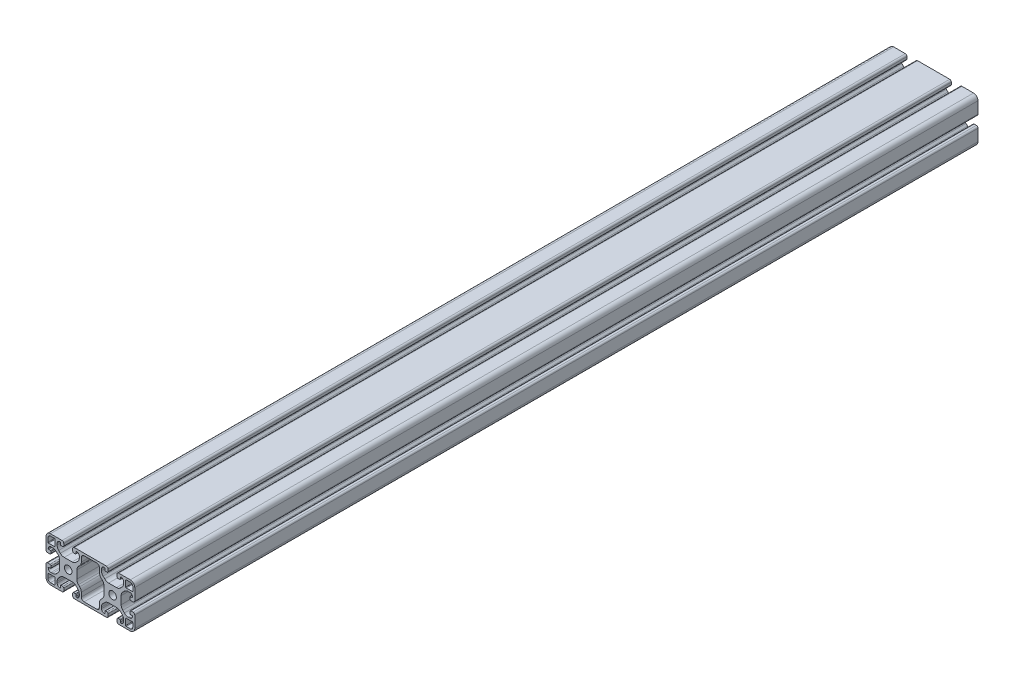
from build123d import *

# Parameters (mm, degrees)
ESQUISSE1_R        = 3.4
BOSS_EXTRU_1_DEPTH = 760


with BuildPart() as part:
    # Esquisse1 → Boss.-Extru.1 (new body)
    with BuildSketch(Plane.XY.offset(20)):
        with BuildLine():
            Line((66.5, 4.5), (65, 4.5))
            ThreePointArc((65, 4.5), (64.292893219, 4.207106781), (64, 3.5))
            Line((64, 3.5), (64, 1.5))
            ThreePointArc((64, 1.5), (64.439339828, 0.439339828), (65.5, 0))
            Line((65.5, 0), (76, 0))
            ThreePointArc((76, 0), (78.828427125, 1.171572875), (80, 4))
            Line((80, 4), (80, 14.5))
            ThreePointArc((80, 14.5), (79.560660172, 15.560660172), (78.5, 16))
            Line((78.5, 16), (76.5, 16))
            ThreePointArc((76.5, 16), (75.792893219, 15.707106781), (75.5, 15))
            Line((75.5, 15), (75.5, 13.5))
            ThreePointArc((75.5, 13.5), (75.646446609, 13.146446609), (76, 13))
            Line((76, 13), (77.5, 13))
            ThreePointArc((77.5, 13), (77.853553391, 12.853553391), (78, 12.5))
            ThreePointArc((78, 12.5), (77.267766953, 10.732233047), (75.5, 10))
            Line((75.5, 10), (74.192388155, 10))
            ThreePointArc((74.192388155, 10), (72.278970994, 10.380602337), (70.656854249, 11.464466094))
            Line((70.656854249, 11.464466094), (69.214466094, 12.906854249))
            ThreePointArc((69.214466094, 12.906854249), (68.130602337, 14.528970994), (67.75, 16.442388155))
            Line((67.75, 16.442388155), (67.75, 23.557611845))
            ThreePointArc((67.75, 23.557611845), (68.130602337, 25.471029006), (69.214466094, 27.093145751))
            Line((69.214466094, 27.093145751), (70.656854249, 28.535533906))
            ThreePointArc((70.656854249, 28.535533906), (72.278970994, 29.619397663), (74.192388155, 30))
            Line((74.192388155, 30), (75.5, 30))
            ThreePointArc((75.5, 30), (77.267766953, 29.267766953), (78, 27.5))
            ThreePointArc((78, 27.5), (77.853553391, 27.146446609), (77.5, 27))
            Line((77.5, 27), (76, 27))
            ThreePointArc((76, 27), (75.646446609, 26.853553391), (75.5, 26.5))
            Line((75.5, 26.5), (75.5, 25))
            ThreePointArc((75.5, 25), (75.792893219, 24.292893219), (76.5, 24))
            Line((76.5, 24), (78.5, 24))
            ThreePointArc((78.5, 24), (79.560660172, 24.439339828), (80, 25.5))
            Line((80, 25.5), (80, 36))
            ThreePointArc((80, 36), (78.828427125, 38.828427125), (76, 40))
            Line((76, 40), (65.5, 40))
            ThreePointArc((65.5, 40), (64.439339828, 39.560660172), (64, 38.5))
            Line((64, 38.5), (64, 36.5))
            ThreePointArc((64, 36.5), (64.292893219, 35.792893219), (65, 35.5))
            Line((65, 35.5), (66.5, 35.5))
            ThreePointArc((66.5, 35.5), (66.853553391, 35.646446609), (67, 36))
            Line((67, 36), (67, 37.5))
            ThreePointArc((67, 37.5), (67.146446609, 37.853553391), (67.5, 38))
            ThreePointArc((67.5, 38), (69.267766953, 37.267766953), (70, 35.5))
            Line((70, 35.5), (70, 34.192388155))
            ThreePointArc((70, 34.192388155), (69.619397663, 32.278970994), (68.535533906, 30.656854249))
            Line((68.535533906, 30.656854249), (67.093145751, 29.214466094))
            ThreePointArc((67.093145751, 29.214466094), (65.471029006, 28.130602337), (63.557611845, 27.75))
            Line((63.557611845, 27.75), (56.442388155, 27.75))
            ThreePointArc((56.442388155, 27.75), (54.528970994, 28.130602337), (52.906854249, 29.214466094))
            Line((52.906854249, 29.214466094), (51.464466094, 30.656854249))
            ThreePointArc((51.464466094, 30.656854249), (50.380602337, 32.278970994), (50, 34.192388155))
            Line((50, 34.192388155), (50, 35.5))
            ThreePointArc((50, 35.5), (50.732233047, 37.267766953), (52.5, 38))
            ThreePointArc((52.5, 38), (52.853553391, 37.853553391), (53, 37.5))
            Line((53, 37.5), (53, 36))
            ThreePointArc((53, 36), (53.146446609, 35.646446609), (53.5, 35.5))
            Line((53.5, 35.5), (55, 35.5))
            ThreePointArc((55, 35.5), (55.707106781, 35.792893219), (56, 36.5))
            Line((56, 36.5), (56, 38.5))
            ThreePointArc((56, 38.5), (55.560660172, 39.560660172), (54.5, 40))
            Line((54.5, 40), (25.5, 40))
            ThreePointArc((25.5, 40), (24.439339828, 39.560660172), (24, 38.5))
            Line((24, 38.5), (24, 36.5))
            ThreePointArc((24, 36.5), (24.292893219, 35.792893219), (25, 35.5))
            Line((25, 35.5), (26.5, 35.5))
            ThreePointArc((26.5, 35.5), (26.853553391, 35.646446609), (27, 36))
            Line((27, 36), (27, 37.5))
            ThreePointArc((27, 37.5), (27.146446609, 37.853553391), (27.5, 38))
            ThreePointArc((27.5, 38), (29.267766953, 37.267766953), (30, 35.5))
            Line((30, 35.5), (30, 34.192388155))
            ThreePointArc((30, 34.192388155), (29.619397663, 32.278970994), (28.535533906, 30.656854249))
            Line((28.535533906, 30.656854249), (27.093145751, 29.214466094))
            ThreePointArc((27.093145751, 29.214466094), (25.471029006, 28.130602337), (23.557611845, 27.75))
            Line((23.557611845, 27.75), (16.442388155, 27.75))
            ThreePointArc((16.442388155, 27.75), (14.528970994, 28.130602337), (12.906854249, 29.214466094))
            Line((12.906854249, 29.214466094), (11.464466094, 30.656854249))
            ThreePointArc((11.464466094, 30.656854249), (10.380602337, 32.278970994), (10, 34.192388155))
            Line((10, 34.192388155), (10, 35.5))
            ThreePointArc((10, 35.5), (10.732233047, 37.267766953), (12.5, 38))
            ThreePointArc((12.5, 38), (12.853553391, 37.853553391), (13, 37.5))
            Line((13, 37.5), (13, 36))
            ThreePointArc((13, 36), (13.146446609, 35.646446609), (13.5, 35.5))
            Line((13.5, 35.5), (15, 35.5))
            ThreePointArc((15, 35.5), (15.707106781, 35.792893219), (16, 36.5))
            Line((16, 36.5), (16, 38.5))
            ThreePointArc((16, 38.5), (15.560660172, 39.560660172), (14.5, 40))
            Line((14.5, 40), (4, 40))
            ThreePointArc((4, 40), (1.171572875, 38.828427125), (0, 36))
            Line((0, 36), (0, 25.5))
            ThreePointArc((0, 25.5), (0.439339828, 24.439339828), (1.5, 24))
            Line((1.5, 24), (3.5, 24))
            ThreePointArc((3.5, 24), (4.207106781, 24.292893219), (4.5, 25))
            Line((4.5, 25), (4.5, 26.5))
            ThreePointArc((4.5, 26.5), (4.353553391, 26.853553391), (4, 27))
            Line((4, 27), (2.5, 27))
            ThreePointArc((2.5, 27), (2.146446609, 27.146446609), (2, 27.5))
            ThreePointArc((2, 27.5), (2.732233047, 29.267766953), (4.5, 30))
            Line((4.5, 30), (5.807611845, 30))
            ThreePointArc((5.807611845, 30), (7.721029006, 29.619397663), (9.343145751, 28.535533906))
            Line((9.343145751, 28.535533906), (10.785533906, 27.093145751))
            ThreePointArc((10.785533906, 27.093145751), (11.869397663, 25.471029006), (12.25, 23.557611845))
            Line((12.25, 23.557611845), (12.25, 16.442388155))
            ThreePointArc((12.25, 16.442388155), (11.869397663, 14.528970994), (10.785533906, 12.906854249))
            Line((10.785533906, 12.906854249), (9.343145751, 11.464466094))
            ThreePointArc((9.343145751, 11.464466094), (7.721029006, 10.380602337), (5.807611845, 10))
            Line((5.807611845, 10), (4.5, 10))
            ThreePointArc((4.5, 10), (2.732233047, 10.732233047), (2, 12.5))
            ThreePointArc((2, 12.5), (2.146446609, 12.853553391), (2.5, 13))
            Line((2.5, 13), (4, 13))
            ThreePointArc((4, 13), (4.353553391, 13.146446609), (4.5, 13.5))
            Line((4.5, 13.5), (4.5, 15))
            ThreePointArc((4.5, 15), (4.207106781, 15.707106781), (3.5, 16))
            Line((3.5, 16), (1.5, 16))
            ThreePointArc((1.5, 16), (0.439339828, 15.560660172), (0, 14.5))
            Line((0, 14.5), (0, 4))
            ThreePointArc((0, 4), (1.171572875, 1.171572875), (4, 0))
            Line((4, 0), (14.5, 0))
            ThreePointArc((14.5, 0), (15.560660172, 0.439339828), (16, 1.5))
            Line((16, 1.5), (16, 3.5))
            ThreePointArc((16, 3.5), (15.707106781, 4.207106781), (15, 4.5))
            Line((15, 4.5), (13.5, 4.5))
            ThreePointArc((13.5, 4.5), (13.146446609, 4.353553391), (13, 4))
            Line((13, 4), (13, 2.5))
            ThreePointArc((13, 2.5), (12.853553391, 2.146446609), (12.5, 2))
            ThreePointArc((12.5, 2), (10.732233047, 2.732233047), (10, 4.5))
            Line((10, 4.5), (10, 5.807611845))
            ThreePointArc((10, 5.807611845), (10.380602337, 7.721029006), (11.464466094, 9.343145751))
            Line((11.464466094, 9.343145751), (12.906854249, 10.785533906))
            ThreePointArc((12.906854249, 10.785533906), (14.528970994, 11.869397663), (16.442388155, 12.25))
            Line((16.442388155, 12.25), (23.557611845, 12.25))
            ThreePointArc((23.557611845, 12.25), (25.471029006, 11.869397663), (27.093145751, 10.785533906))
            Line((27.093145751, 10.785533906), (28.535533906, 9.343145751))
            ThreePointArc((28.535533906, 9.343145751), (29.619397663, 7.721029006), (30, 5.807611845))
            Line((30, 5.807611845), (30, 4.5))
            ThreePointArc((30, 4.5), (29.267766953, 2.732233047), (27.5, 2))
            ThreePointArc((27.5, 2), (27.146446609, 2.146446609), (27, 2.5))
            Line((27, 2.5), (27, 4))
            ThreePointArc((27, 4), (26.853553391, 4.353553391), (26.5, 4.5))
            Line((26.5, 4.5), (25, 4.5))
            ThreePointArc((25, 4.5), (24.292893219, 4.207106781), (24, 3.5))
            Line((24, 3.5), (24, 1.5))
            ThreePointArc((24, 1.5), (24.439339828, 0.439339828), (25.5, 0))
            Line((25.5, 0), (54.5, 0))
            ThreePointArc((54.5, 0), (55.560660172, 0.439339828), (56, 1.5))
            Line((56, 1.5), (56, 3.5))
            ThreePointArc((56, 3.5), (55.707106781, 4.207106781), (55, 4.5))
            Line((55, 4.5), (53.5, 4.5))
            ThreePointArc((53.5, 4.5), (53.146446609, 4.353553391), (53, 4))
            Line((53, 4), (53, 2.5))
            ThreePointArc((53, 2.5), (52.853553391, 2.146446609), (52.5, 2))
            ThreePointArc((52.5, 2), (50.732233047, 2.732233047), (50, 4.5))
            Line((50, 4.5), (50, 5.807611845))
            ThreePointArc((50, 5.807611845), (50.380602337, 7.721029006), (51.464466094, 9.343145751))
            Line((51.464466094, 9.343145751), (52.906854249, 10.785533906))
            ThreePointArc((52.906854249, 10.785533906), (54.528970994, 11.869397663), (56.442388155, 12.25))
            Line((56.442388155, 12.25), (63.557611845, 12.25))
            ThreePointArc((63.557611845, 12.25), (65.471029006, 11.869397663), (67.093145751, 10.785533906))
            Line((67.093145751, 10.785533906), (68.535533906, 9.343145751))
            ThreePointArc((68.535533906, 9.343145751), (69.619397663, 7.721029006), (70, 5.807611845))
            Line((70, 5.807611845), (70, 4.5))
            ThreePointArc((70, 4.5), (69.267766953, 2.732233047), (67.5, 2))
            ThreePointArc((67.5, 2), (67.146446609, 2.146446609), (67, 2.5))
            Line((67, 2.5), (67, 4))
            ThreePointArc((67, 4), (66.853553391, 4.353553391), (66.5, 4.5))
        make_face()
        with Locations(Location((20, 20, 0), (0, 0, 180))):
            Circle(ESQUISSE1_R, mode=Mode.SUBTRACT)
        with Locations(Location((60, 20, 0), (0, 0, 180))):
            Circle(ESQUISSE1_R, mode=Mode.SUBTRACT)
        with BuildLine():
            Line((31.8, 4.5), (31.8, 8.250252532))
            ThreePointArc((31.8, 8.250252532), (31.419397663, 10.163669694), (30.335533906, 11.785786438))
            Line((30.335533906, 11.785786438), (29.214466094, 12.906854249))
            ThreePointArc((29.214466094, 12.906854249), (28.130602337, 14.528970994), (27.75, 16.442388155))
            Line((27.75, 16.442388155), (27.75, 23.557611845))
            ThreePointArc((27.75, 23.557611845), (28.130602337, 25.471029006), (29.214466094, 27.093145751))
            Line((29.214466094, 27.093145751), (30.335533906, 28.214213562))
            ThreePointArc((30.335533906, 28.214213562), (31.419397663, 29.836330306), (31.8, 31.749747468))
            Line((31.8, 31.749747468), (31.8, 35.5))
            ThreePointArc((31.8, 35.5), (32.532233047, 37.267766953), (34.3, 38))
            Line((34.3, 38), (45.7, 38))
            ThreePointArc((45.7, 38), (47.467766953, 37.267766953), (48.2, 35.5))
            Line((48.2, 35.5), (48.2, 31.749747468))
            ThreePointArc((48.2, 31.749747468), (48.580602337, 29.836330306), (49.664466094, 28.214213562))
            Line((49.664466094, 28.214213562), (50.785533906, 27.093145751))
            ThreePointArc((50.785533906, 27.093145751), (51.869397663, 25.471029006), (52.25, 23.557611845))
            Line((52.25, 23.557611845), (52.25, 16.442388155))
            ThreePointArc((52.25, 16.442388155), (51.869397663, 14.528970994), (50.785533906, 12.906854249))
            Line((50.785533906, 12.906854249), (49.664466094, 11.785786438))
            ThreePointArc((49.664466094, 11.785786438), (48.580602337, 10.163669694), (48.2, 8.250252532))
            Line((48.2, 8.250252532), (48.2, 4.5))
            ThreePointArc((48.2, 4.5), (47.467766953, 2.732233047), (45.7, 2))
            Line((45.7, 2), (34.3, 2))
            ThreePointArc((34.3, 2), (32.532233047, 2.732233047), (31.8, 4.5))
        make_face(mode=Mode.SUBTRACT)
        with BuildLine():
            Line((7.7, 1.8), (4, 1.8))
            ThreePointArc((4, 1.8), (2.444365081, 2.444365081), (1.8, 4))
            Line((1.8, 4), (1.8, 7.7))
            ThreePointArc((1.8, 7.7), (1.946446609, 8.053553391), (2.3, 8.2))
            Line((2.3, 8.2), (7.7, 8.2))
            ThreePointArc((7.7, 8.2), (8.053553391, 8.053553391), (8.2, 7.7))
            Line((8.2, 7.7), (8.2, 2.3))
            ThreePointArc((8.2, 2.3), (8.053553391, 1.946446609), (7.7, 1.8))
        make_face(mode=Mode.SUBTRACT)
        with BuildLine():
            Line((72.3, 38.2), (76, 38.2))
            ThreePointArc((76, 38.2), (77.555634919, 37.555634919), (78.2, 36))
            Line((78.2, 36), (78.2, 32.3))
            ThreePointArc((78.2, 32.3), (78.053553391, 31.946446609), (77.7, 31.8))
            Line((77.7, 31.8), (72.3, 31.8))
            ThreePointArc((72.3, 31.8), (71.946446609, 31.946446609), (71.8, 32.3))
            Line((71.8, 32.3), (71.8, 37.7))
            ThreePointArc((71.8, 37.7), (71.946446609, 38.053553391), (72.3, 38.2))
        make_face(mode=Mode.SUBTRACT)
        with BuildLine():
            Line((78.2, 7.7), (78.2, 4))
            ThreePointArc((78.2, 4), (77.555634919, 2.444365081), (76, 1.8))
            Line((76, 1.8), (72.3, 1.8))
            ThreePointArc((72.3, 1.8), (71.946446609, 1.946446609), (71.8, 2.3))
            Line((71.8, 2.3), (71.8, 7.7))
            ThreePointArc((71.8, 7.7), (71.946446609, 8.053553391), (72.3, 8.2))
            Line((72.3, 8.2), (77.7, 8.2))
            ThreePointArc((77.7, 8.2), (78.053553391, 8.053553391), (78.2, 7.7))
        make_face(mode=Mode.SUBTRACT)
        with BuildLine():
            Line((1.8, 32.3), (1.8, 36))
            ThreePointArc((1.8, 36), (2.444365081, 37.555634919), (4, 38.2))
            Line((4, 38.2), (7.7, 38.2))
            ThreePointArc((7.7, 38.2), (8.053553391, 38.053553391), (8.2, 37.7))
            Line((8.2, 37.7), (8.2, 32.3))
            ThreePointArc((8.2, 32.3), (8.053553391, 31.946446609), (7.7, 31.8))
            Line((7.7, 31.8), (2.3, 31.8))
            ThreePointArc((2.3, 31.8), (1.946446609, 31.946446609), (1.8, 32.3))
        make_face(mode=Mode.SUBTRACT)
    extrude(amount=-BOSS_EXTRU_1_DEPTH)


solid = part.part
